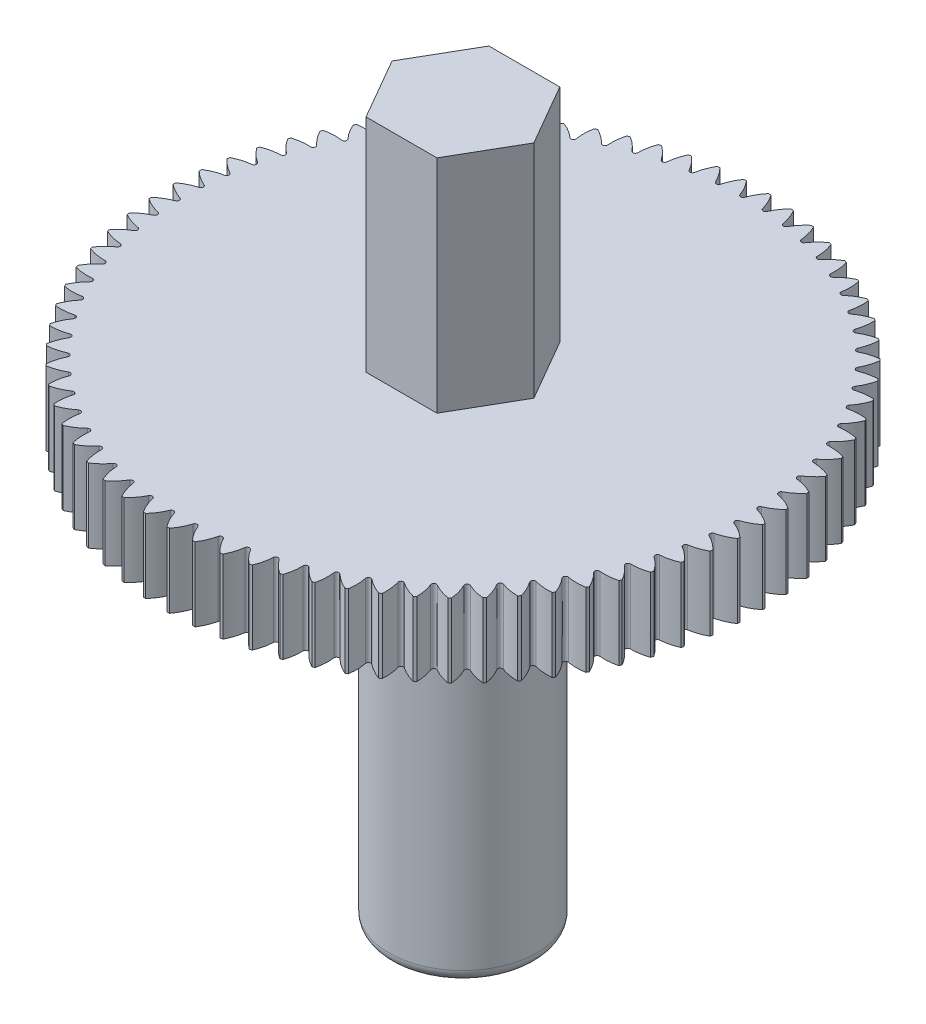
from build123d import *

# Parameters (mm, degrees)
FILLET1_R          = 0.5
CUT_EXTRUDE1_START = -9
SKETCH2_R          = 3
CUT_EXTRUDE1_DEPTH = 9
CUT_EXTRUDE2_START = -4
CUT_EXTRUDE2_DEPTH = 4
CIRPATTERN1_COUNT  = 75


with BuildPart() as part:
    # Sketch1 → Revolve1 (revolve)
    with BuildSketch(Plane.XY, mode=Mode.PRIVATE) as revolve1_sk:
        Polygon((0, 0), (0, 29), (3, 29), (3, 20), (12, 20), (12, 17), (3, 17), (3, 0), align=None)
    revolve(revolve1_sk.sketch.rotate(Axis((0, 0, 0), (0, 1, 0)), 90), axis=Axis((0, 0, 0), (0, 1, 0)))

    # Fillet1
    fillet1_edges = [part.edges().sort_by_distance(p)[0] for p in [
        (0, 0, 3),
    ]]
    fillet(fillet1_edges, radius=FILLET1_R)

    # Sketch2 → Cut-Extrude1 (cut)
    with BuildSketch(Plane(origin=(0, 29, 0), x_dir=(1, 0, 0), z_dir=(0, 1, 0)).offset(CUT_EXTRUDE1_START)):
        with Locations(Location((0, 0, 0), (0, 0, 90))):
            Circle(SKETCH2_R)
        Polygon((1.443375673, -2.5), (2.886751346, 0), (1.443375673, 2.5), (-1.443375673, 2.5), (-2.886751346, 0), (-1.443375673, -2.5), align=None, mode=Mode.SUBTRACT)
    extrude(amount=CUT_EXTRUDE1_DEPTH, mode=Mode.SUBTRACT)

    # Sketch3 → Cut-Extrude2 (cut)
    with BuildSketch(Plane(origin=(0, 20, 0), x_dir=(1, 0, 0), z_dir=(0, 1, 0)).offset(CUT_EXTRUDE2_START)):
        with BuildLine():
            ThreePointArc((0.45, 11.991559532), (0, 12), (-0.45, 11.991559532))
            ThreePointArc((-0.45, 11.991559532), (-0.244185037, 11.69752696), (-0.094236566, 11.371443523))
            ThreePointArc((-0.094236566, 11.371443523), (0, 11.304902), (0.094236566, 11.371443523))
            ThreePointArc((0.094236566, 11.371443523), (0.244185037, 11.69752696), (0.45, 11.991559532))
        make_face()
    cut_extrude2 = extrude(amount=CUT_EXTRUDE2_DEPTH, mode=Mode.SUBTRACT)

    # CirPattern1: Cut-Extrude2 ×75 about axis
    cirpattern1_axis = Axis((0, 0, 0), (0, 1, 0))
    for i in range(1, CIRPATTERN1_COUNT):
        add(cut_extrude2.rotate(cirpattern1_axis, i * 360 / CIRPATTERN1_COUNT), mode=Mode.SUBTRACT)


solid = part.part
